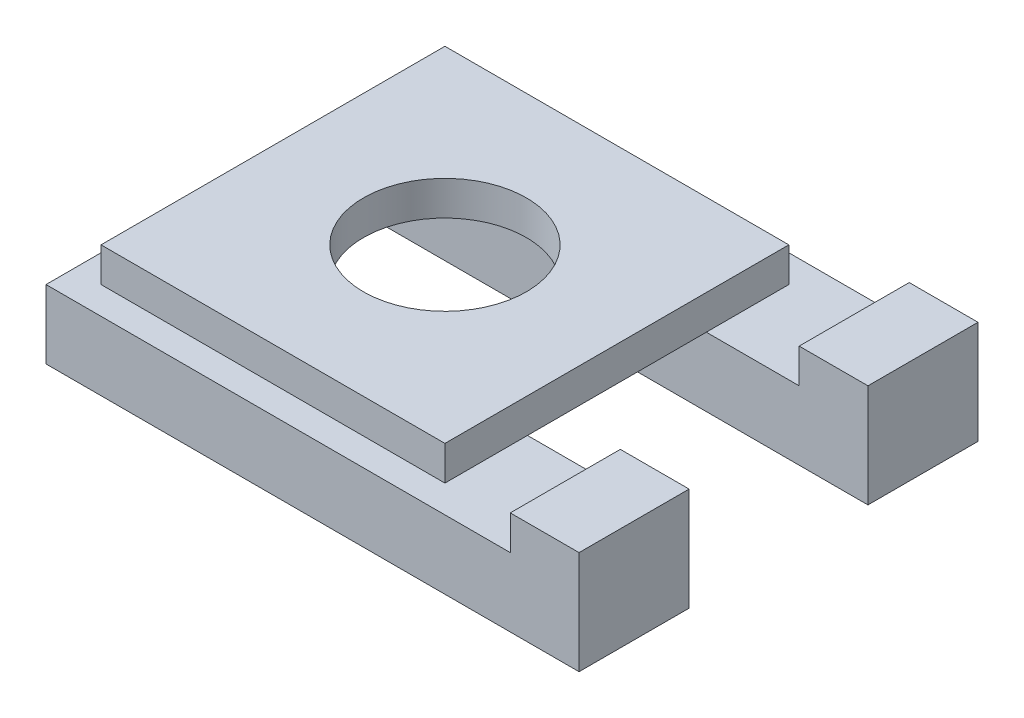
from build123d import *

# Parameters (mm, degrees)
SKETCH1_W                = 100
SKETCH1_H                = 100
SKETCH1_R                = 23.682087014
BOSS_EXTRUDE1_DEPTH      = 10
SKETCH2_W                = 135
SKETCH2_H                = 32
BOSS_EXTRUDE2_DEPTH      = 20
BOSS_EXTRUDE3_DEPTH      = 20
BOSS_EXTRUDE3_DEPTH_BACK = 10
SKETCH2_3_W              = 20
SKETCH2_3_H              = 32


with BuildPart() as part:
    # Sketch1 → Boss-Extrude1 (new body)
    with BuildSketch(Plane(origin=(0, 0, 0), x_dir=(1, 0, 0), z_dir=(0, 1, 0))):
        Rectangle(SKETCH1_W, SKETCH1_H)
        Circle(SKETCH1_R, mode=Mode.SUBTRACT)
    extrude(amount=BOSS_EXTRUDE1_DEPTH)

    # Sketch2 → Boss-Extrude2 (add)
    with BuildSketch(Plane.XZ):
        with Locations((9.5, 42)):
            Rectangle(SKETCH2_W, SKETCH2_H)
        with Locations((9.5, -42)):
            Rectangle(SKETCH2_W, SKETCH2_H)
    extrude(amount=BOSS_EXTRUDE2_DEPTH)

    # Sketch2<3> → Boss-Extrude3 (add, two sides: drawn at the far end of the back side and taken through both)
    with BuildSketch(Plane.XZ.offset(-BOSS_EXTRUDE3_DEPTH_BACK)):
        with Locations((87, 42)):
            Rectangle(SKETCH2_3_W, SKETCH2_3_H)
        with Locations((87, -42)):
            Rectangle(SKETCH2_3_W, SKETCH2_3_H)
    extrude(amount=BOSS_EXTRUDE3_DEPTH + BOSS_EXTRUDE3_DEPTH_BACK)


solid = part.part
